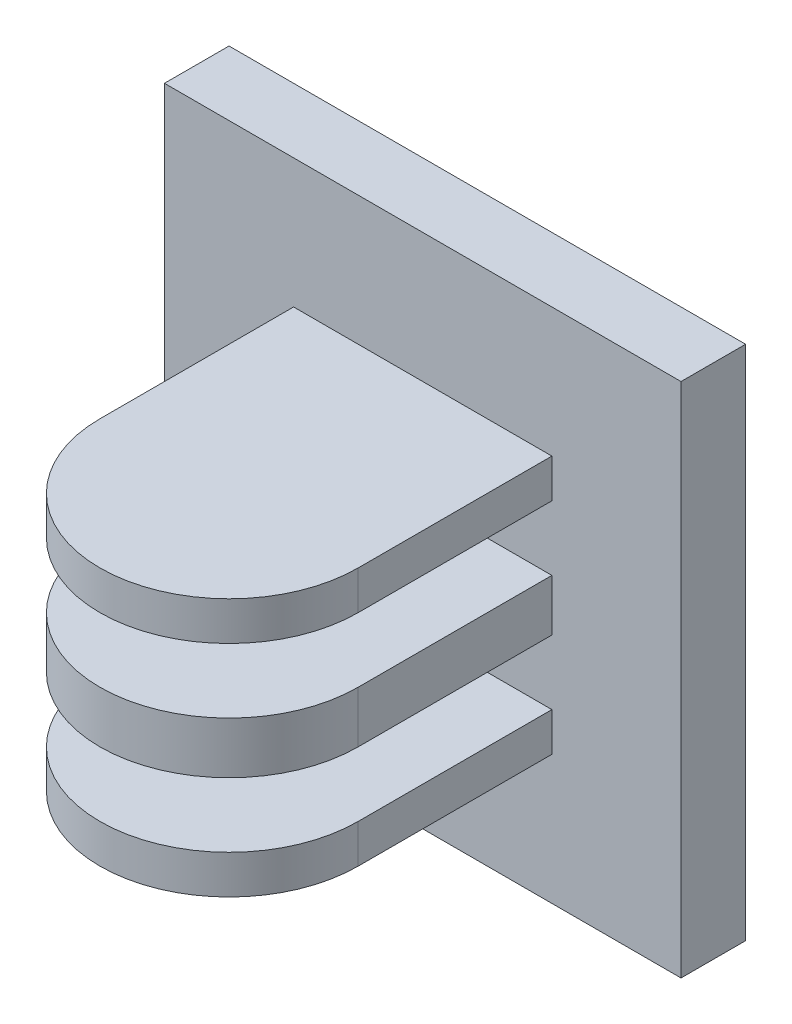
from build123d import *

# Parameters (mm, degrees)
SKETCH1_W           = 40
SKETCH1_H           = 40
BOSS_EXTRUDE1_DEPTH = 5
BOSS_EXTRUDE2_START = 10
BOSS_EXTRUDE2_DEPTH = 20
CUT_EXTRUDE1_START  = -3
CUT_EXTRUDE1_DEPTH  = 5
CUT_EXTRUDE2_START  = -12
CUT_EXTRUDE2_DEPTH  = 5


with BuildPart() as part:
    # Sketch1 → Boss-Extrude1 (new body)
    with BuildSketch(Plane.XY):
        Rectangle(SKETCH1_W, SKETCH1_H)
    extrude(amount=BOSS_EXTRUDE1_DEPTH)

    # Sketch2 → Boss-Extrude2 (add)
    with BuildSketch(Plane(origin=(0, 0, 0), x_dir=(1, 0, 0), z_dir=(0, 1, 0)).offset(BOSS_EXTRUDE2_START)):
        with BuildLine():
            Line((10, -5), (-10, -5))
            Line((-10, -5), (-10, -20))
            ThreePointArc((-10, -20), (0, -30), (10, -20))
            Line((10, -20), (10, -5))
        make_face()
    extrude(amount=-BOSS_EXTRUDE2_DEPTH)

    # Sketch3 → Cut-Extrude1 (cut)
    with BuildSketch(Plane(origin=(0, 10, 0), x_dir=(1, 0, 0), z_dir=(0, 1, 0)).offset(CUT_EXTRUDE1_START)):
        with BuildLine():
            Line((10, -20), (10, -5))
            Line((10, -5), (-10, -5))
            Line((-10, -5), (-10, -20))
            ThreePointArc((-10, -20), (0, -30), (10, -20))
        make_face()
    extrude(amount=-CUT_EXTRUDE1_DEPTH, mode=Mode.SUBTRACT)

    # Sketch4 → Cut-Extrude2 (cut)
    with BuildSketch(Plane(origin=(0, 10, 0), x_dir=(1, 0, 0), z_dir=(0, 1, 0)).offset(CUT_EXTRUDE2_START)):
        with BuildLine():
            Line((10, -20), (10, -5))
            Line((10, -5), (-10, -5))
            Line((-10, -5), (-10, -20))
            ThreePointArc((-10, -20), (0, -30), (10, -20))
        make_face()
    extrude(amount=-CUT_EXTRUDE2_DEPTH, mode=Mode.SUBTRACT)


solid = part.part
